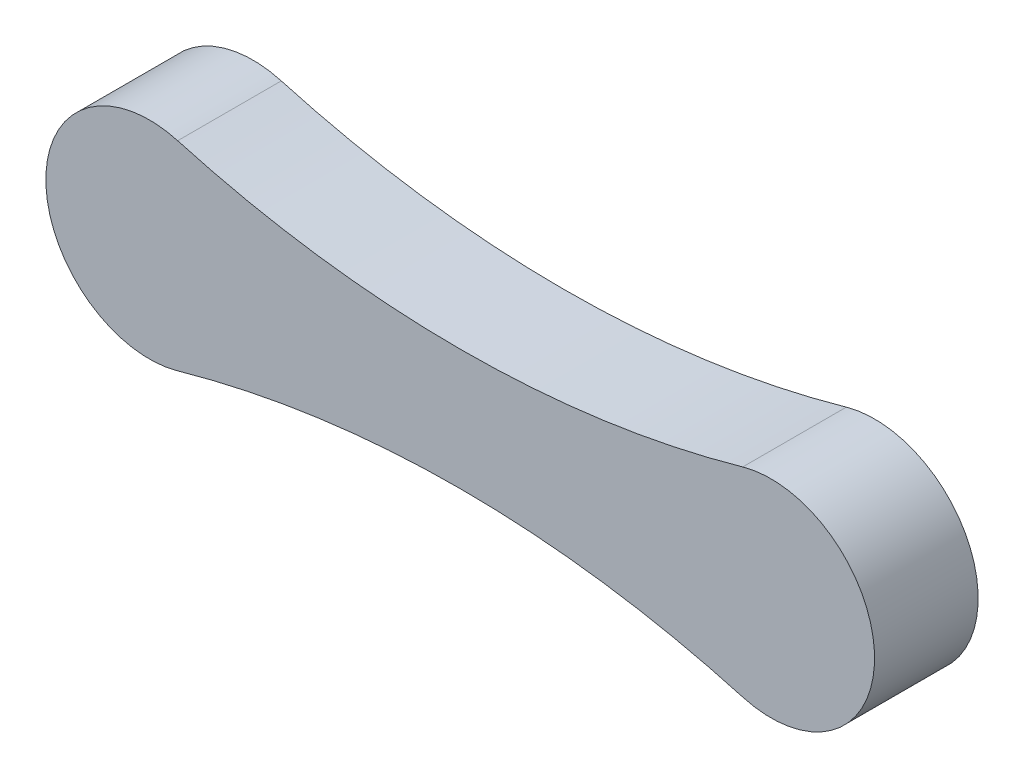
from build123d import *

# Parameters (mm, degrees)
BOSS_EXTRUDE1_DEPTH = 5


with BuildPart() as part:
    # Sketch1 → Boss-Extrude1 (new body)
    with BuildSketch(Plane.XY):
        with BuildLine():
            ThreePointArc((28.636363636, 4.810456929), (15, 2.915026221), (1.363636364, 4.810456929))
            ThreePointArc((1.363636364, 4.810456929), (-5, 0), (1.363636364, -4.810456929))
            ThreePointArc((1.363636364, -4.810456929), (15, -2.915026221), (28.636363636, -4.810456929))
            ThreePointArc((28.636363636, -4.810456929), (35, 0), (28.636363636, 4.810456929))
        make_face()
    extrude(amount=BOSS_EXTRUDE1_DEPTH)


solid = part.part
